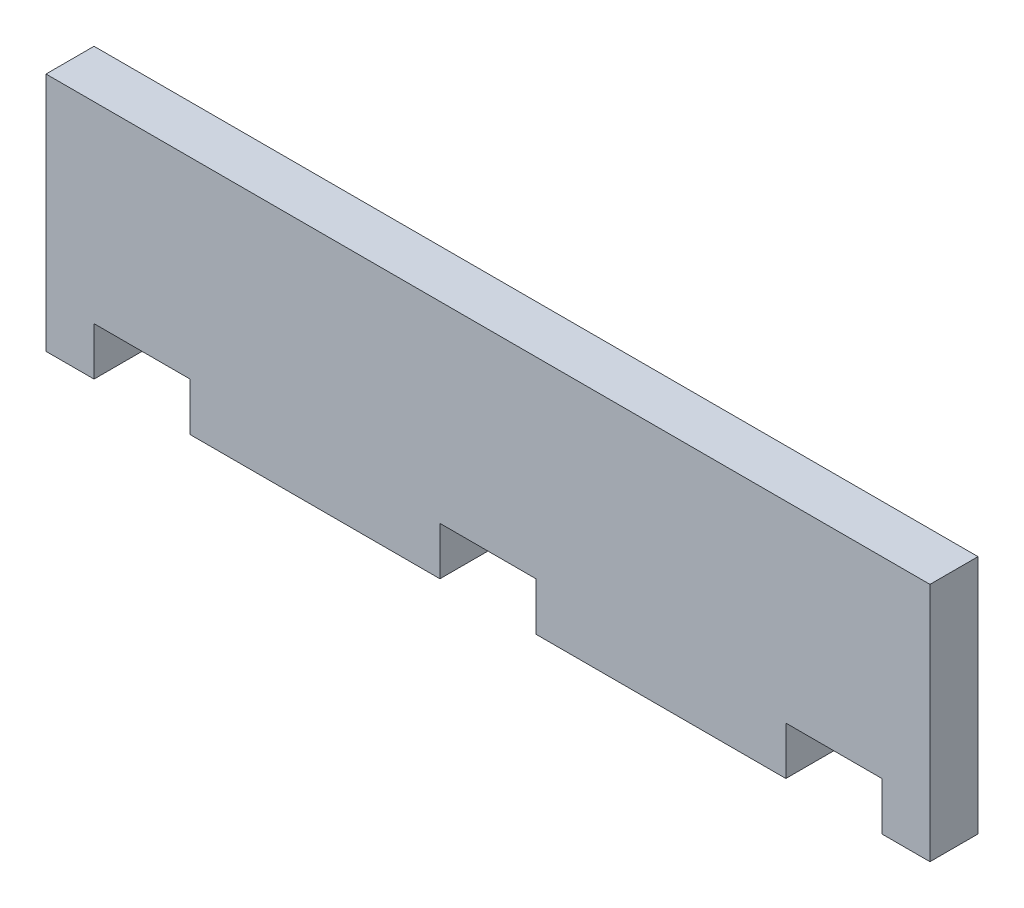
from build123d import *

# Parameters (mm, degrees)
SKETCH1_W           = 116.84
SKETCH1_H           = 31.75
BOSS_EXTRUDE1_DEPTH = 6.35
SKETCH2_W           = 12.7
SKETCH2_H           = 6.35
CUT_EXTRUDE1_DEPTH  = 6.35


with BuildPart() as part:
    # Sketch1 → Boss-Extrude1 (new body)
    with BuildSketch(Plane.XY):
        with Locations((58.42, 15.875)):
            Rectangle(SKETCH1_W, SKETCH1_H)
    extrude(amount=BOSS_EXTRUDE1_DEPTH)

    # Sketch2 → Cut-Extrude1 (cut)
    with BuildSketch(Plane.XY.offset(6.35)):
        with Locations((12.7, 3.175)):
            Rectangle(SKETCH2_W, SKETCH2_H)
        with Locations((104.14, 3.175)):
            Rectangle(SKETCH2_W, SKETCH2_H)
        with Locations((58.42, 3.175)):
            Rectangle(SKETCH2_W, SKETCH2_H)
    extrude(amount=-CUT_EXTRUDE1_DEPTH, mode=Mode.SUBTRACT)


solid = part.part
